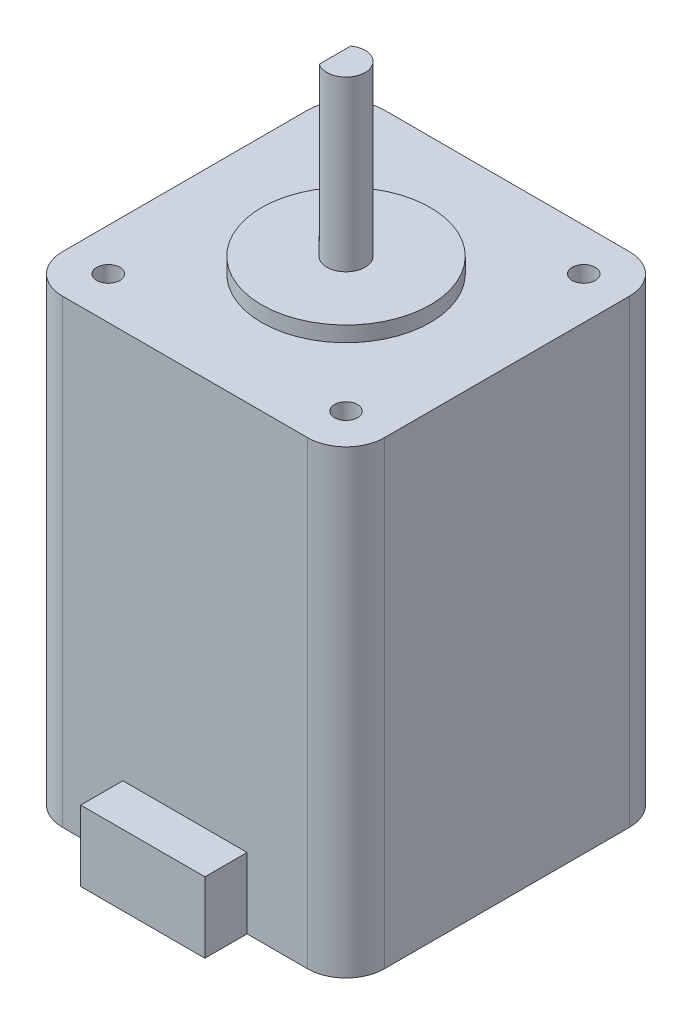
from build123d import *

# Parameters (mm, degrees)
SKETCH_1_W          = 42
SKETCH_1_H          = 42
EXTRUDE_1_DEPTH     = 60
SKETCH_2_R          = 11
EXTRUDE_2_DEPTH     = 2
SKETCH_3_R          = 2.5
EXTRUDE_3_DEPTH     = 22
SKETCH_5_W          = 16.2
SKETCH_5_H          = 9.2
EXTRUDE_4_DEPTH     = 5.5
SKETCH_6_R          = 1.5
CUT_EXTRUDE_1_DEPTH = 5
FILLET_1_R          = 5
SKETCH_7_R          = 4
CUT_EXTRUDE_2_DEPTH = 5
CUT_EXTRUDE_START   = -20
CUT_EXTRUDE_3_DEPTH = 20


with BuildPart() as part:
    # 草图1 → 凸台-拉伸1 (new body)
    with BuildSketch(Plane(origin=(0, 0, 0), x_dir=(1, 0, 0), z_dir=(0, 1, 0))):
        Rectangle(SKETCH_1_W, SKETCH_1_H)
    extrude(amount=EXTRUDE_1_DEPTH)

    # 草图2 → 凸台-拉伸2 (add)
    with BuildSketch(Plane(origin=(0, 60, 0), x_dir=(1, 0, 0), z_dir=(0, 1, 0))):
        with Locations(Location((0, 0, 0), (0, 0, 270))):
            Circle(SKETCH_2_R)
    extrude(amount=EXTRUDE_2_DEPTH)

    # 草图3 → 凸台-拉伸3 (add)
    with BuildSketch(Plane(origin=(0, 62, 0), x_dir=(1, 0, 0), z_dir=(0, 1, 0))):
        with Locations(Location((0, 0, 0), (0, 0, 270))):
            Circle(SKETCH_3_R)
    extrude(amount=EXTRUDE_3_DEPTH)

    # 草图5 → 凸台-拉伸4 (add)
    with BuildSketch(Plane.XY.offset(21)):
        with Locations((0, 4.6)):
            Rectangle(SKETCH_5_W, SKETCH_5_H)
    extrude(amount=EXTRUDE_4_DEPTH)

    # 草图6 → 切除-拉伸1 (cut)
    with BuildSketch(Plane(origin=(0, 60, 0), x_dir=(1, 0, 0), z_dir=(0, 1, 0))):
        with Locations(Location((-15.5, 15.5, 0), (0, 0, 270))):
            Circle(SKETCH_6_R)
        with Locations(Location((15.5, 15.5, 0), (0, 0, 270))):
            Circle(SKETCH_6_R)
        with Locations(Location((15.5, -15.5, 0), (0, 0, 270))):
            Circle(SKETCH_6_R)
        with Locations(Location((-15.5, -15.5, 0), (0, 0, 270))):
            Circle(SKETCH_6_R)
    extrude(amount=-CUT_EXTRUDE_1_DEPTH, mode=Mode.SUBTRACT)

    # 圆角1
    fillet_1_edges = [part.edges().sort_by_distance(p)[0] for p in [
        (21, 30, 21),
        (-21, 30, 21),
        (-21, 30, -21),
        (21, 30, -21),
    ]]
    fillet(fillet_1_edges, radius=FILLET_1_R)

    # 草图7 → 切除-拉伸2 (cut)
    with BuildSketch(Plane.XZ):
        with Locations(Location((0, 0, 0), (0, 0, 270))):
            Circle(SKETCH_7_R)
    extrude(amount=-CUT_EXTRUDE_2_DEPTH, mode=Mode.SUBTRACT)

    # 草图8 → 切除-拉伸3 (cut)
    with BuildSketch(Plane(origin=(0, 84, 0), x_dir=(1, 0, 0), z_dir=(0, 1, 0)).offset(CUT_EXTRUDE_START)):
        with BuildLine():
            Line((-1.438247, -2.044858324), (-1.438247, 2.044858324))
            ThreePointArc((-1.438247, 2.044858324), (-2.5, 0), (-1.438247, -2.044858324))
        make_face()
    extrude(amount=CUT_EXTRUDE_3_DEPTH, mode=Mode.SUBTRACT)


solid = part.part
